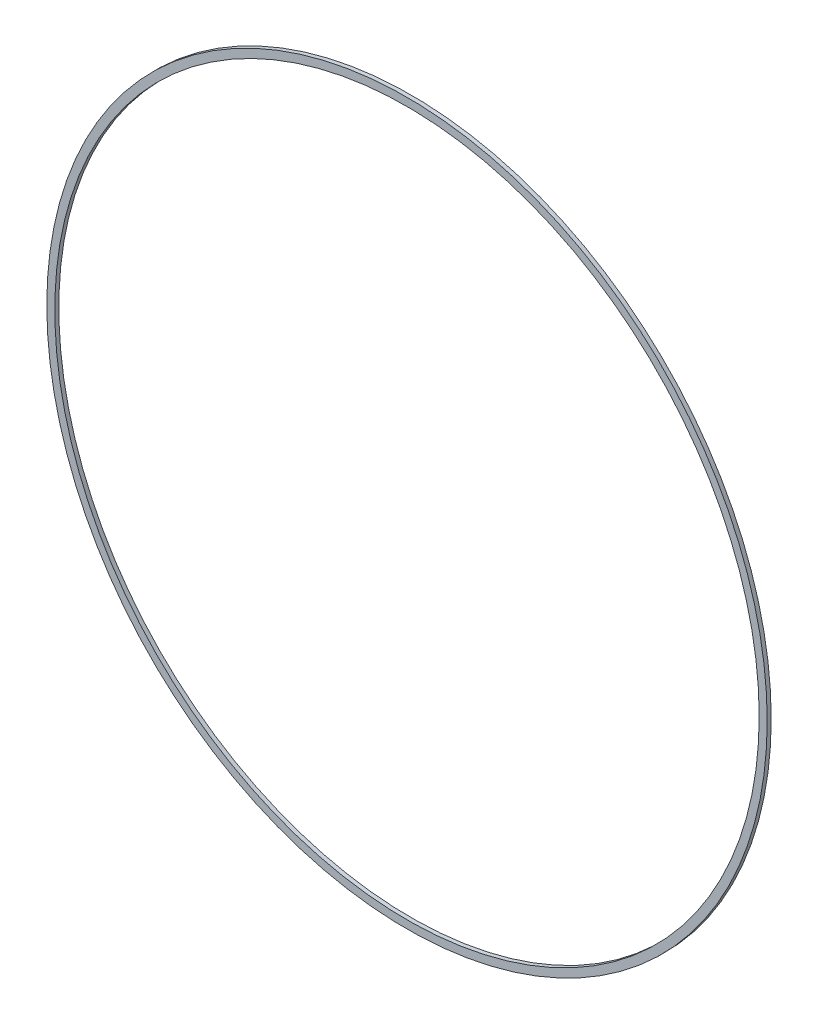
from build123d import *

# Parameters (mm, degrees)
SKETCH_1_R      = 90
SKETCH_1_R_2    = 88
EXTRUDE_1_DEPTH = 1


with BuildPart() as part:
    # 草图1 → 凸台-拉伸1 (new body)
    with BuildSketch(Plane.XY):
        Circle(SKETCH_1_R)
        Circle(SKETCH_1_R_2, mode=Mode.SUBTRACT)
    extrude(amount=EXTRUDE_1_DEPTH)


solid = part.part
